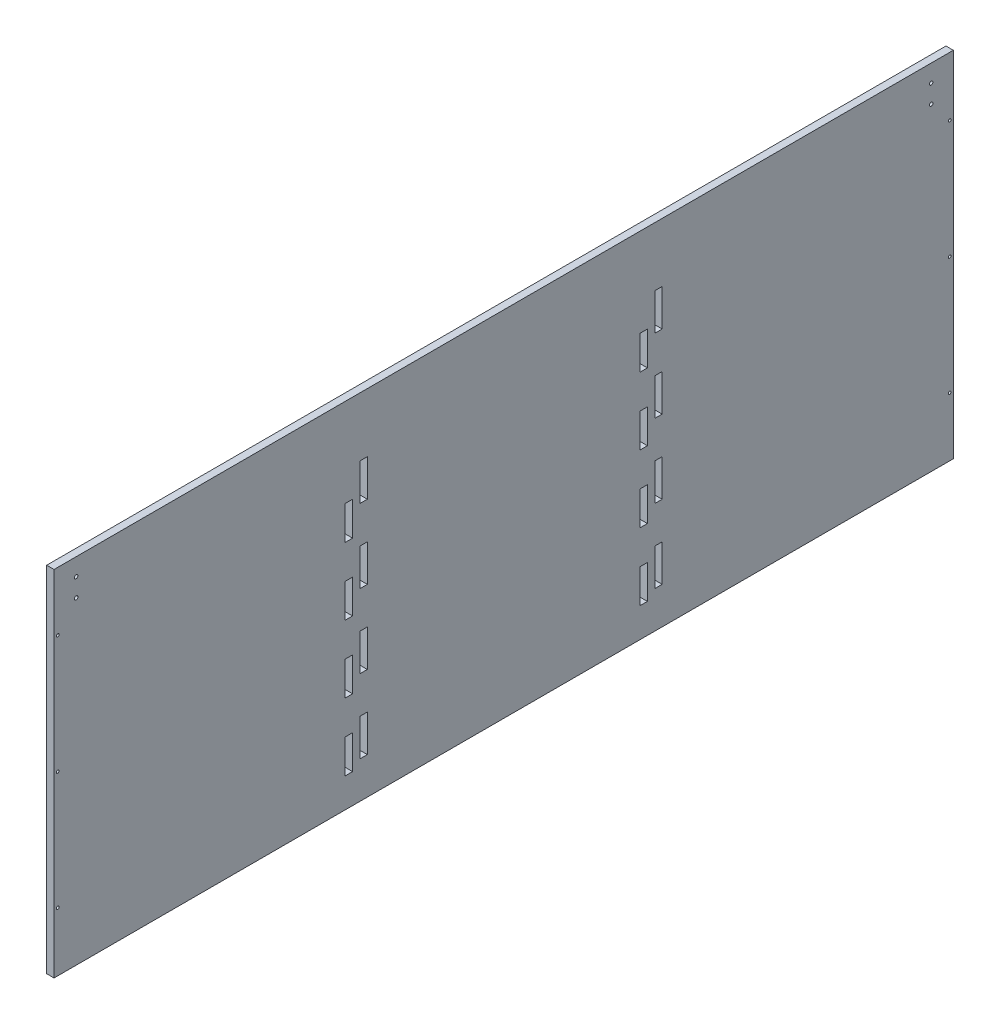
from build123d import *

# Parameters (mm, degrees)
BOSS_EXTRUDE1_DEPTH            = 6.35
SKETCH3_W                      = 6.35
SKETCH3_H                      = 31.75
SKETCH3_H_2                    = 29.028571429
CUT_EXTRUDE1_DEPTH             = 419.66682159
SKETCH4_R                      = 1.5
CUT_EXTRUDE2_DEPTH             = 6.35
SKETCH5_W                      = 6.35
SKETCH5_H                      = 44.45
SKETCH5_W_2                    = 59.592307692
SKETCH5_H_2                    = 6.35
CUT_EXTRUDE3_DEPTH             = 6.35
SKETCH6_W                      = 6.35
SKETCH6_H                      = 222.25
BOSS_EXTRUDE2_DEPTH            = 6.35
SKETCH7_W                      = 774.7
SKETCH7_H                      = 14.696452311
CUT_EXTRUDE4_DEPTH             = 6.35
SKETCH8_R                      = 1.190625
HOLES_FOR_PLASTIC_SCREWS_DEPTH = 10


with BuildPart() as part:
    # Sketch1 → Boss-Extrude1 (new body)
    with BuildSketch(Plane(origin=(0, 0, 0), x_dir=(0, 0, -1), z_dir=(1, 0, 0))):
        Polygon((-387.35, 152.4), (-387.35, 107.95), (-381, 107.95), (-381, 63.5), (-387.35, 63.5), (-387.35, 19.05), (-381, 19.05), (-381, -25.4), (-387.35, -25.4), (-387.35, -69.85), (-381, -69.85), (-381, -114.3), (-387.35, -114.3), (-387.35, -152.4), (-327.757692308, -152.4), (-327.757692308, -158.75), (-268.165384615, -158.75), (-268.165384615, -152.4), (-208.573076923, -152.4), (-208.573076923, -158.75), (-148.980769231, -158.75), (-148.980769231, -152.4), (-89.388461538, -152.4), (-89.388461538, -158.75), (-29.796153846, -158.75), (-29.796153846, -152.4), (29.796153846, -152.4), (29.796153846, -158.75), (89.388461538, -158.75), (89.388461538, -152.4), (148.980769231, -152.4), (148.980769231, -158.75), (208.573076923, -158.75), (208.573076923, -152.4), (268.165384615, -152.4), (268.165384615, -158.75), (327.757692308, -158.75), (327.757692308, -152.4), (387.35, -152.4), (387.35, -114.3), (381, -114.3), (381, -69.85), (387.35, -69.85), (387.35, -25.4), (381, -25.4), (381, 19.05), (387.35, 19.05), (387.35, 63.5), (381, 63.5), (381, 107.95), (387.35, 107.95), (387.35, 152.4), align=None)
    extrude(amount=BOSS_EXTRUDE1_DEPTH)

    # Sketch3 → Cut-Extrude1 (cut, through all)
    with BuildSketch(Plane(origin=(6.35, 0, 0), x_dir=(0, 0, -1), z_dir=(1, 0, 0))):
        with Locations((-120.648769685, -104.775)):
            Rectangle(SKETCH3_W, SKETCH3_H)
        with Locations((-120.648769685, -41.275)):
            Rectangle(SKETCH3_W, SKETCH3_H)
        with Locations((-120.648769685, 22.225)):
            Rectangle(SKETCH3_W, SKETCH3_H)
        with Locations((-120.648769685, 85.725)):
            Rectangle(SKETCH3_W, SKETCH3_H)
        with Locations((-133.351230315, 61.685714285)):
            Rectangle(SKETCH3_W, SKETCH3_H_2)
        with Locations((-133.351230315, 3.628571428)):
            Rectangle(SKETCH3_W, SKETCH3_H_2)
        with Locations((-133.351230315, -54.428571428)):
            Rectangle(SKETCH3_W, SKETCH3_H_2)
        with Locations((-133.351230315, -112.485714286)):
            Rectangle(SKETCH3_W, SKETCH3_H_2)
        with Locations((133.351230315, 85.725)):
            Rectangle(SKETCH3_W, SKETCH3_H)
        with Locations((120.648769685, 61.685714285)):
            Rectangle(SKETCH3_W, SKETCH3_H_2)
        with Locations((133.351230315, 22.225)):
            Rectangle(SKETCH3_W, SKETCH3_H)
        with Locations((120.648769685, 3.628571428)):
            Rectangle(SKETCH3_W, SKETCH3_H_2)
        with Locations((133.351230315, -41.275)):
            Rectangle(SKETCH3_W, SKETCH3_H)
        with Locations((120.648769685, -54.428571428)):
            Rectangle(SKETCH3_W, SKETCH3_H_2)
        with Locations((133.351230315, -104.775)):
            Rectangle(SKETCH3_W, SKETCH3_H)
        with Locations((120.648769685, -112.485714286)):
            Rectangle(SKETCH3_W, SKETCH3_H_2)
    extrude(amount=-CUT_EXTRUDE1_DEPTH, mode=Mode.SUBTRACT)

    # Sketch4 → Cut-Extrude2 (cut)
    with BuildSketch(Plane(origin=(6.35, 0, 0), x_dir=(0, 0, -1), z_dir=(1, 0, 0))):
        with Locations((-368.3, 137.4)):
            Circle(SKETCH4_R)
        with Locations((-368.3, 121.65)):
            Circle(SKETCH4_R)
        with Locations((368.3, 137.4)):
            Circle(SKETCH4_R)
        with Locations((368.3, 121.65)):
            Circle(SKETCH4_R)
    extrude(amount=-CUT_EXTRUDE2_DEPTH, mode=Mode.SUBTRACT)

    # Sketch5 → Cut-Extrude3 (cut)
    with BuildSketch(Plane(origin=(6.35, 0, 0), x_dir=(0, 0, -1), z_dir=(1, 0, 0))):
        with Locations((-384.175, 41.275)):
            Rectangle(SKETCH5_W, SKETCH5_H)
        with Locations((-384.175, -47.625)):
            Rectangle(SKETCH5_W, SKETCH5_H)
        with Locations((-178.776923077, -155.575)):
            Rectangle(SKETCH5_W_2, SKETCH5_H_2)
        with Locations((-59.592307692, -155.575)):
            Rectangle(SKETCH5_W_2, SKETCH5_H_2)
        with Locations((59.592307692, -155.575)):
            Rectangle(SKETCH5_W_2, SKETCH5_H_2)
        with Locations((178.776923077, -155.575)):
            Rectangle(SKETCH5_W_2, SKETCH5_H_2)
        with Locations((384.175, -47.625)):
            Rectangle(SKETCH5_W, SKETCH5_H)
        with Locations((384.175, 41.275)):
            Rectangle(SKETCH5_W, SKETCH5_H)
    extrude(amount=-CUT_EXTRUDE3_DEPTH, mode=Mode.SUBTRACT)

    # Sketch6 → Boss-Extrude2 (add)
    with BuildSketch(Plane(origin=(6.35, 0, 0), x_dir=(0, 0, -1), z_dir=(1, 0, 0))):
        with Locations((-384.175, -3.175)):
            Rectangle(SKETCH6_W, SKETCH6_H)
        with Locations((384.175, -3.175)):
            Rectangle(SKETCH6_W, SKETCH6_H)
    extrude(amount=-BOSS_EXTRUDE2_DEPTH)

    # Sketch7 → Cut-Extrude4 (cut)
    with BuildSketch(Plane(origin=(6.35, 0, 0), x_dir=(0, 0, -1), z_dir=(1, 0, 0))):
        with Locations((0, -159.748226155)):
            Rectangle(SKETCH7_W, SKETCH7_H)
    extrude(amount=-CUT_EXTRUDE4_DEPTH, mode=Mode.SUBTRACT)

    # Sketch8 → Holes for plastic screws (cut)
    with BuildSketch(Plane(origin=(6.35, 0, 0), x_dir=(0, 0, -1), z_dir=(1, 0, 0))):
        with Locations((384.175, 101.6)):
            Circle(SKETCH8_R)
        with Locations((384.175, 0)):
            Circle(SKETCH8_R)
        with Locations((384.175, -101.6)):
            Circle(SKETCH8_R)
        with Locations((-384.175, -101.6)):
            Circle(SKETCH8_R)
        with Locations((-384.175, 0)):
            Circle(SKETCH8_R)
        with Locations((-384.175, 101.6)):
            Circle(SKETCH8_R)
    extrude(amount=-HOLES_FOR_PLASTIC_SCREWS_DEPTH, mode=Mode.SUBTRACT)


solid = part.part
